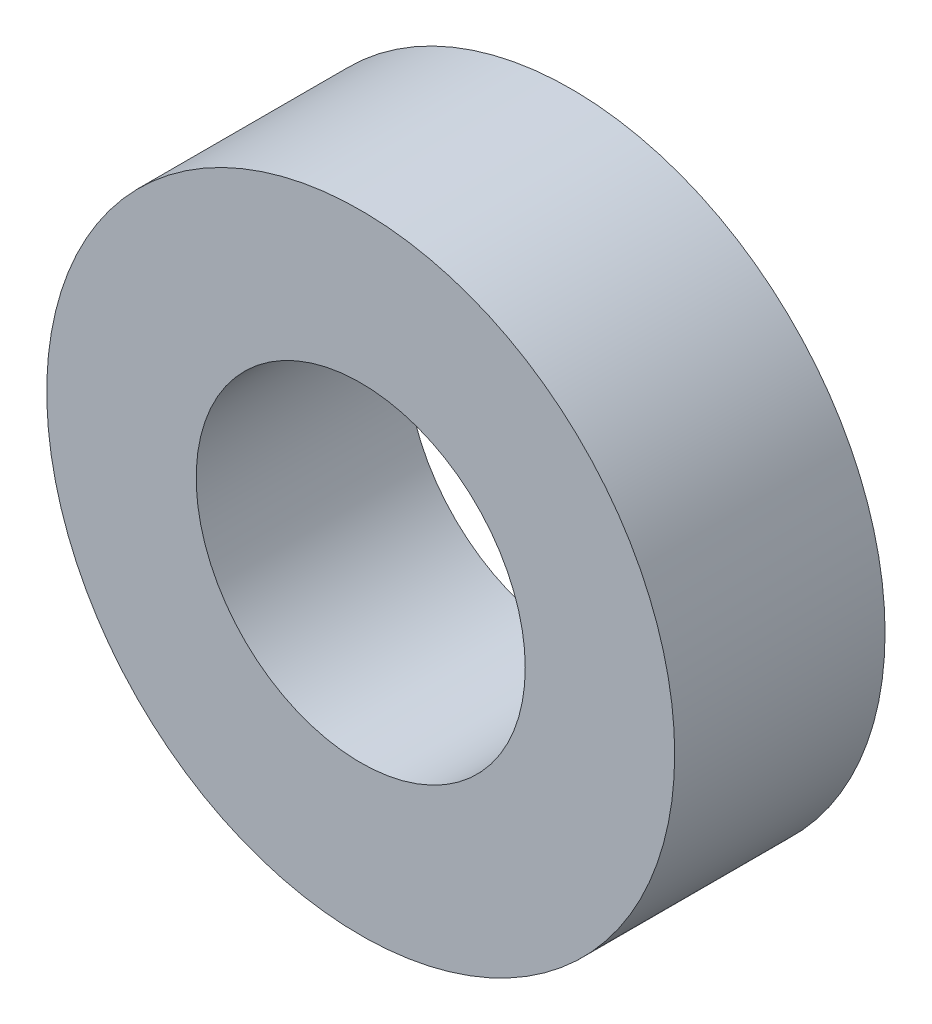
from build123d import *

# Parameters (mm, degrees)
SKETCH1_R           = 4.7498
SKETCH1_R_2         = 2.4892
BOSS_EXTRUDE1_DEPTH = 3.18262


with BuildPart() as part:
    # Sketch1 → Boss-Extrude1 (new body)
    with BuildSketch(Plane.XY):
        Circle(SKETCH1_R)
        Circle(SKETCH1_R_2, mode=Mode.SUBTRACT)
    extrude(amount=BOSS_EXTRUDE1_DEPTH)


solid = part.part
